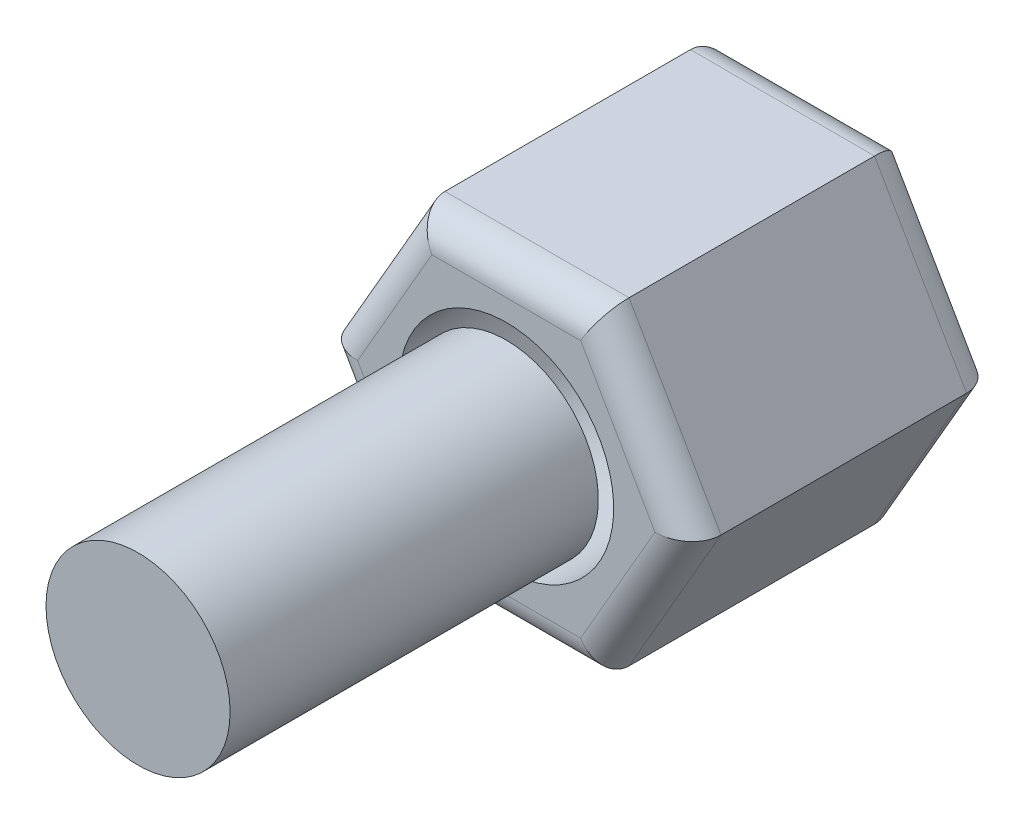
from build123d import *

# Parameters (mm, degrees)
EXTRUDE_2_DEPTH     = 5
SKETCH_2_R          = 1.5
EXTRUDE_3_DEPTH     = 6
SKETCH_3_R          = 1.75
CUT_EXTRUDE_1_DEPTH = 5
FILLET_1_R          = 0.5


with BuildPart() as part:
    # ｽｹｯﾁ1 → ﾎﾞｽ - 押し出し2 (new body)
    with BuildSketch(Plane.XY):
        Polygon((3, 0), (1.5, 2.598076211), (-1.5, 2.598076211), (-3, 0), (-1.5, -2.598076211), (1.5, -2.598076211), align=None)
    extrude(amount=EXTRUDE_2_DEPTH)

    # ｽｹｯﾁ2 → ﾎﾞｽ - 押し出し3 (add)
    with BuildSketch(Plane.XY.offset(5)):
        Circle(SKETCH_2_R)
    extrude(amount=EXTRUDE_3_DEPTH)

    # ｽｹｯﾁ3 → ｶｯﾄ - 押し出し1 (cut)
    with BuildSketch(Plane(origin=(0, 0, 0), x_dir=(-1, 0, 0), z_dir=(0, 0, -1))):
        Circle(SKETCH_3_R)
    extrude(amount=-CUT_EXTRUDE_1_DEPTH, mode=Mode.SUBTRACT)


with BuildPart() as cut_extrude_1_piece_1:
    # of the separate pieces the step leaves, piece 1, a body of its own (cut_extrude_1_pieces)
    add(part.part.solids().sort_by_distance((3, 0, 0))[0])

    # ﾌｨﾚｯﾄ1
    fillet_1_edges = [cut_extrude_1_piece_1.edges().sort_by_distance(p)[0] for p in [
        (2.25, -1.299038106, 5),
        (2.25, 1.299038106, 5),
        (0, 2.598076211, 5),
        (-2.25, 1.299038106, 5),
        (-2.25, -1.299038106, 5),
        (0, -2.598076211, 5),
        (2.25, -1.299038106, 0),
        (2.25, 1.299038106, 0),
        (0, 2.598076211, 0),
        (-2.25, 1.299038106, 0),
        (-2.25, -1.299038106, 0),
        (0, -2.598076211, 0),
    ]]
    fillet(fillet_1_edges, radius=FILLET_1_R)


with BuildPart() as cut_extrude_1_piece_2:
    # of the separate pieces the step leaves, piece 2, a body of its own (cut_extrude_1_pieces)
    add(part.part.solids().sort_by_distance((1.5, 0, 5))[0])


solid = Compound([cut_extrude_1_piece_1.part, cut_extrude_1_piece_2.part])
